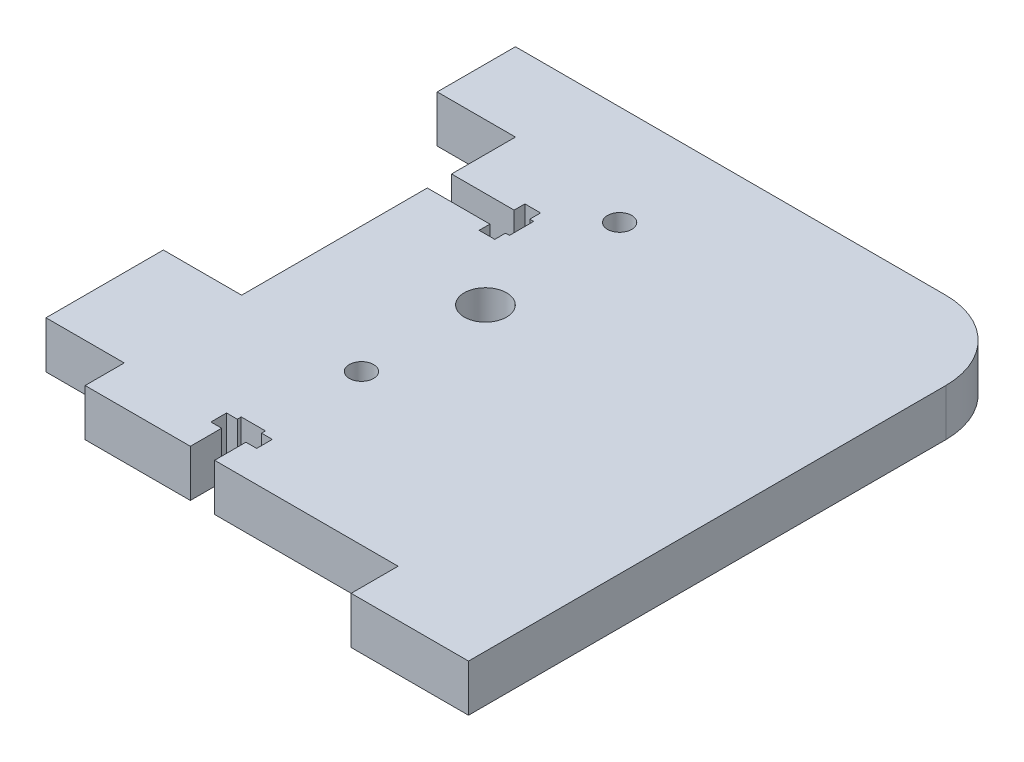
from build123d import *

# Parameters (mm, degrees)
DODANIE_WYCI_GNI_CIE2_DEPTH      = 3
DODANIE_WYCI_GNI_CIE2_DEPTH_BACK = 3
SZKIC2_W                         = 50
SZKIC2_H                         = 6
WYTNIJ_WYCI_GNI_CIE1_DEPTH       = 6
WYTNIJ_WYCI_GNI_CIE2_DEPTH       = 6
SZKIC4_W                         = 10
SZKIC4_H                         = 35
SZKIC4_H_2                       = 5
WYTNIJ_WYCI_GNI_CIE3_DEPTH       = 6
WYTNIJ_WYCI_GNI_CIE4_DEPTH       = 6
DODANIE_WYCI_GNI_CIE3_DEPTH      = 6
SZKIC8_R                         = 1.55
SZKIC8_R_2                       = 2.7
WYTNIJ_WYCI_GNI_CIE5_DEPTH       = 6


with BuildPart() as part:
    # Szkic1 → Dodanie-wyciągnięcie2 (new, two sides: drawn at the far end of the back side and taken through both)
    with BuildSketch(Plane(origin=(0, -418.87633849, -418.87633849), x_dir=(1, 0, 0), z_dir=(0, 1, 0)).offset(-DODANIE_WYCI_GNI_CIE2_DEPTH_BACK)):
        Polygon((-1165.368459045, -408.87633849), (-1142.368459045, -408.87633849), (-1142.368459045, -459.87633849), (-1100.368459045, -459.87633849), (-1100.368459045, -479.87633849), (-1165.368459045, -479.87633849), align=None)
    extrude(amount=DODANIE_WYCI_GNI_CIE2_DEPTH + DODANIE_WYCI_GNI_CIE2_DEPTH_BACK)

    # Szkic2 → Wytnij-wyciągnięcie1 (cut)
    with BuildSketch(Plane.XY.offset(61)):
        with Locations((-1140.368459045, -418.87633849)):
            Rectangle(SZKIC2_W, SZKIC2_H)
    extrude(amount=-WYTNIJ_WYCI_GNI_CIE1_DEPTH, mode=Mode.SUBTRACT)

    # Szkic3 → Wytnij-wyciągnięcie2 (cut)
    with BuildSketch(Plane(origin=(0, -415.87633849, 0), x_dir=(1, 0, 0), z_dir=(0, 1, 0))):
        Polygon((-1138.818459045, -55), (-1141.918459045, -55), (-1141.918459045, -51), (-1143.293459045, -51), (-1143.293459045, -49), (-1141.918459045, -49), (-1141.918459045, -48.5), (-1138.818459045, -48.5), (-1138.818459045, -49), (-1137.443459045, -49), (-1137.443459045, -51), (-1138.818459045, -51), align=None)
    extrude(amount=-WYTNIJ_WYCI_GNI_CIE2_DEPTH, mode=Mode.SUBTRACT)

    # Szkic4 → Wytnij-wyciągnięcie3 (cut)
    with BuildSketch(Plane(origin=(0, -415.87633849, 0), x_dir=(1, 0, 0), z_dir=(0, 1, 0))):
        with Locations((-1160.368459045, -17.5)):
            Rectangle(SZKIC4_W, SZKIC4_H)
        with Locations((-1160.368459045, -52.5)):
            Rectangle(SZKIC4_W, SZKIC4_H_2)
    extrude(amount=-WYTNIJ_WYCI_GNI_CIE3_DEPTH, mode=Mode.SUBTRACT)

    # Szkic5 → Wytnij-wyciągnięcie4 (cut)
    with BuildSketch(Plane(origin=(0, -415.87633849, 0), x_dir=(1, 0, 0), z_dir=(0, 1, 0))):
        Polygon((-1155.368459045, -8.168218351), (-1147.368459045, -8.168218351), (-1147.368459045, -6.793218351), (-1145.368459045, -6.793218351), (-1145.368459045, -8.168218351), (-1144.868459045, -8.168218351), (-1144.868459045, -11.268218351), (-1145.368459045, -11.268218351), (-1145.368459045, -12.643218351), (-1147.368459045, -12.643218351), (-1147.368459045, -11.268218351), (-1155.368459045, -11.268218351), align=None)
    extrude(amount=-WYTNIJ_WYCI_GNI_CIE4_DEPTH, mode=Mode.SUBTRACT)


with BuildPart() as body_2:
    # Szkic9 → Dodanie-wyciągnięcie3 (new body)
    with BuildSketch(Plane(origin=(0, -415.87633849, 0), x_dir=(1, 0, 0), z_dir=(0, 1, 0))):
        with BuildLine():
            Line((-1142.368459045, 10), (-1142.368459045, -41))
            Line((-1142.368459045, -41), (-1100.368459045, -41))
            Line((-1100.368459045, -41), (-1100.368459045, 0))
            ThreePointArc((-1100.368459045, 0), (-1103.297391233, 7.071067812), (-1110.368459045, 10))
            Line((-1110.368459045, 10), (-1142.368459045, 10))
        make_face()
    extrude(amount=-DODANIE_WYCI_GNI_CIE3_DEPTH)

    # Połącz3: union part
    add(part.part)

    # Szkic8 → Wytnij-wyciągnięcie5 (cut)
    with BuildSketch(Plane.XZ.offset(421.87633849)):
        with Locations((-1139.26479978, 35.789778966)):
            Circle(SZKIC8_R)
        with Locations((-1139.26479978, 2.789778966)):
            Circle(SZKIC8_R)
        with Locations((-1138.705640448, 20.5)):
            Circle(SZKIC8_R_2)
    extrude(amount=-WYTNIJ_WYCI_GNI_CIE5_DEPTH, mode=Mode.SUBTRACT)


solid = body_2.part
